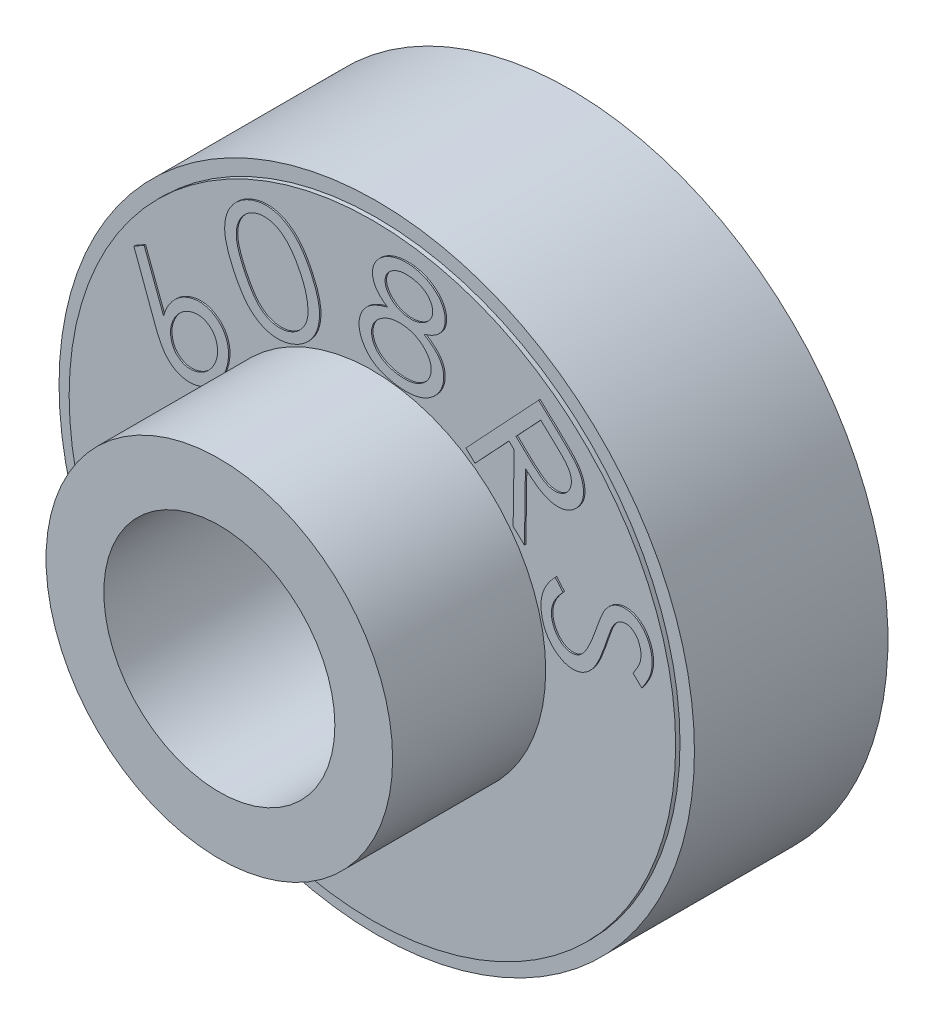
from build123d import *

# Parameters (mm, degrees)
SKETCH1_R           = 11
BOSS_EXTRUDE1_DEPTH = 7
SKETCH2_R           = 4
CUT_EXTRUDE1_DEPTH  = 18.058722109
BOSS_EXTRUDE2_START = 5.3
SKETCH3_R           = 6
SKETCH3_R_2         = 4
BOSS_EXTRUDE2_DEPTH = 5.3
CUT_EXTRUDE2_START  = -0.15
SKETCH4_R           = 11
SKETCH4_R_2         = 10.5
CUT_EXTRUDE2_DEPTH  = 0.15
SKETCH5_R           = 21
SKETCH5_R_2         = 10
CUT_EXTRUDE3_DEPTH  = 0.15
BOSS_EXTRUDE3_DEPTH = 0.05


with BuildPart() as part:
    # Sketch1 → Boss-Extrude1 (new body)
    with BuildSketch(Plane.XY):
        Circle(SKETCH1_R)
    extrude(amount=BOSS_EXTRUDE1_DEPTH)

    # Sketch2 → Cut-Extrude1 (cut, through all)
    with BuildSketch(Plane.XY.offset(7)):
        Circle(SKETCH2_R)
    extrude(amount=-CUT_EXTRUDE1_DEPTH, mode=Mode.SUBTRACT)

    # Sketch3 → Boss-Extrude2 (add)
    with BuildSketch(Plane.XY.offset(7).offset(BOSS_EXTRUDE2_START)):
        Circle(SKETCH3_R)
        Circle(SKETCH3_R_2, mode=Mode.SUBTRACT)
    extrude(amount=-BOSS_EXTRUDE2_DEPTH)

    # Sketch4 → Cut-Extrude2 (cut)
    with BuildSketch(Plane.XY.offset(7).offset(CUT_EXTRUDE2_START)):
        Circle(SKETCH4_R)
        Circle(SKETCH4_R_2, mode=Mode.SUBTRACT)
    extrude(amount=CUT_EXTRUDE2_DEPTH, mode=Mode.SUBTRACT)

    # Sketch5 → Cut-Extrude3 (cut)
    with BuildSketch(Plane(origin=(0, 0, 0), x_dir=(-1, 0, 0), z_dir=(0, 0, -1))):
        Circle(SKETCH5_R)
        Circle(SKETCH5_R_2, mode=Mode.SUBTRACT)
    extrude(amount=-CUT_EXTRUDE3_DEPTH, mode=Mode.SUBTRACT)

    # Sketch8 → Boss-Extrude3 (add)
    # profile 1 of 5: a face of its own
    with BuildSketch(Plane.XY.offset(7)):
        with BuildLine():
            Line((6.378778496, 3.007549075), (6.648131962, 2.692190334))
            add(Edge.make_bspline(
                [(6.648131962, 2.692190334), (6.609031635, 2.649307577), (6.533818589, 2.566818681), (6.43715366, 2.436922009), (6.3601824, 2.307647175), (6.301710334, 2.178949007), (6.263415079, 2.050609597), (6.244176513, 1.922963116), (6.245150647, 1.795821088), (6.261005358, 1.713307836), (6.268959452, 1.671912055)],
                knots=[0, 0, 0, 0, 1.224524167, 2.355484011, 3.411241252, 4.395197411, 5.331915322, 6.229090028, 7.111558467, 8, 8, 8, 8], degree=3))
            add(Edge.make_bspline(
                [(6.268959452, 1.671912055), (6.278641468, 1.637055208), (6.297709341, 1.568407735), (6.338400468, 1.470011998), (6.389160296, 1.378051204), (6.44778949, 1.292322911), (6.514020041, 1.216331489), (6.585574924, 1.151695012), (6.661898216, 1.099784491), (6.74195957, 1.061108556), (6.824105164, 1.035694376), (6.906072479, 1.022983014), (6.98761866, 1.022203641), (7.040266181, 1.032385495), (7.066631561, 1.037484471)],
                knots=[0, 0, 0, 0, 1.152674187, 2.27008969, 3.38536036, 4.496608802, 5.575283695, 6.591710815, 7.562861209, 8.50814768, 9.416117746, 10.293893154, 11.145597844, 12, 12, 12, 12], degree=3))
            add(Edge.make_bspline(
                [(7.066631561, 1.037484471), (7.096354164, 1.046376484), (7.156803326, 1.064460858), (7.239578135, 1.116136467), (7.318272565, 1.18268576), (7.362601996, 1.237964922), (7.385700404, 1.266768826)],
                knots=[0, 0, 0, 0, 0.925563858, 1.882390955, 2.896593112, 4, 4, 4, 4], degree=3))
            add(Edge.make_bspline(
                [(7.385700404, 1.266768826), (7.401753739, 1.289870412), (7.435674567, 1.338684256), (7.48456664, 1.418997293), (7.533441076, 1.510478092), (7.58194047, 1.613420271), (7.632729091, 1.726646121), (7.682575456, 1.851469182), (7.734090261, 1.986677759), (7.767080753, 2.080929076), (7.784165449, 2.129738745)],
                knots=[0, 0, 0, 0, 0.707852986, 1.495699242, 2.364580492, 3.316758505, 4.358943962, 5.487088347, 6.698645388, 8, 8, 8, 8], degree=3))
            add(Edge.make_bspline(
                [(7.784165449, 2.129738745), (7.801114293, 2.178506088), (7.833449926, 2.271546231), (7.881477769, 2.403813745), (7.927387848, 2.521773695), (7.970738202, 2.625685526), (8.009414508, 2.716512621), (8.04636927, 2.793117013), (8.080757038, 2.855628798), (8.104517271, 2.891423487), (8.115106621, 2.907376298)],
                knots=[0, 0, 0, 0, 1.462770368, 2.790727419, 3.986683802, 5.048638873, 5.980783097, 6.783139191, 7.457675118, 8, 8, 8, 8], degree=3))
            add(Edge.make_bspline(
                [(8.115106621, 2.907376298), (8.131759803, 2.93045908), (8.164311148, 2.975578122), (8.219315185, 3.036595874), (8.2762825, 3.091770782), (8.336363652, 3.140408881), (8.400177628, 3.181183477), (8.466077648, 3.216561412), (8.535717509, 3.244088559), (8.583686504, 3.257529337), (8.607808277, 3.264288191)],
                knots=[0, 0, 0, 0, 1.096990083, 2.144245076, 3.162959619, 4.153643437, 5.119398055, 6.079482833, 7.034245381, 8, 8, 8, 8], degree=3))
            add(Edge.make_bspline(
                [(8.607808277, 3.264288191), (8.646486998, 3.271975308), (8.722841757, 3.287150265), (8.839692871, 3.287879861), (8.955022735, 3.271535449), (9.068227857, 3.236923165), (9.177233867, 3.185790737), (9.279815415, 3.117933822), (9.375662863, 3.034893591), (9.462124339, 2.936108917), (9.540076963, 2.826210554), (9.605017746, 2.705799932), (9.659905721, 2.577746253), (9.684090604, 2.487262864), (9.696352448, 2.441387383)],
                knots=[0, 0, 0, 0, 0.933345565, 1.842495663, 2.754874964, 3.686283647, 4.638691146, 5.600067626, 6.593747552, 7.63654653, 8.705618078, 9.781729028, 10.875326747, 12, 12, 12, 12], degree=3))
            add(Edge.make_bspline(
                [(9.696352448, 2.441387383), (9.707019714, 2.391864217), (9.728089931, 2.294044983), (9.737367797, 2.144898634), (9.731945146, 1.997083965), (9.712417377, 1.874468808), (9.688070604, 1.775721033), (9.662650731, 1.699112647), (9.630031522, 1.620584318), (9.593319184, 1.538325123), (9.548580177, 1.454438581), (9.497790364, 1.367827695), (9.44055447, 1.278916241), (9.399233305, 1.219401843), (9.378025625, 1.188856667)],
                knots=[0, 0, 0, 0, 1.360256031, 2.686807307, 4.004512524, 5.330613728, 6.016044099, 6.737309068, 7.497960589, 8.301441016, 9.15808543, 10.052210119, 11.000316091, 12, 12, 12, 12], degree=3))
            Line((9.378025625, 1.188856667), (9.073797193, 1.480470749))
            add(Edge.make_bspline(
                [(9.073797193, 1.480470749), (9.090403688, 1.505179984), (9.122469906, 1.552892142), (9.168383102, 1.622446491), (9.207692517, 1.689475771), (9.241662241, 1.752943597), (9.270881315, 1.812834098), (9.29568561, 1.868740445), (9.314325469, 1.921647196), (9.332129165, 1.986972795), (9.345704563, 2.067299554), (9.351024077, 2.164127807), (9.344650248, 2.262434163), (9.330858152, 2.32699697), (9.323858123, 2.35976512)],
                knots=[0, 0, 0, 0, 1.131436103, 2.184740201, 3.166495598, 4.083236792, 4.919803993, 5.698613236, 6.406150164, 7.049183892, 8.269978557, 9.493700834, 10.727955128, 12, 12, 12, 12], degree=3))
            add(Edge.make_bspline(
                [(9.323858123, 2.35976512), (9.312485648, 2.400273078), (9.290601842, 2.478221658), (9.238829439, 2.584255299), (9.173279569, 2.674768445), (9.095023137, 2.747841791), (9.008690335, 2.802649684), (8.917328804, 2.83560099), (8.822377745, 2.847706911), (8.76031761, 2.836105782), (8.728757629, 2.830206159)],
                knots=[0, 0, 0, 0, 1.193356898, 2.296350651, 3.332124494, 4.351248378, 5.320234367, 6.215905125, 7.092718718, 8, 8, 8, 8], degree=3))
            add(Edge.make_bspline(
                [(8.728757629, 2.830206159), (8.709550579, 2.824734085), (8.671048103, 2.813764759), (8.616041659, 2.788837294), (8.563532582, 2.75752192), (8.513512721, 2.718020662), (8.465396305, 2.668519737), (8.417616717, 2.607809754), (8.371353615, 2.534103981), (8.343002485, 2.47969659), (8.328066524, 2.45103365)],
                knots=[0, 0, 0, 0, 0.838196921, 1.680250597, 2.528629587, 3.401851773, 4.349855777, 5.422707971, 6.642229246, 8, 8, 8, 8], degree=3))
            add(Edge.make_bspline(
                [(8.328066524, 2.45103365), (8.323275502, 2.440436468), (8.311803892, 2.415062603), (8.294394839, 2.369265597), (8.272196367, 2.310470694), (8.246248847, 2.237894955), (8.21578561, 2.152168032), (8.181790527, 2.052354214), (8.143261161, 1.939384711), (8.116544459, 1.859411569), (8.102492271, 1.817348086)],
                knots=[0, 0, 0, 0, 0.414771559, 0.993127911, 1.746959378, 2.65679128, 3.742298553, 4.99229321, 6.418036107, 8, 8, 8, 8], degree=3))
            add(Edge.make_bspline(
                [(8.102492271, 1.817348086), (8.085251418, 1.766529202), (8.05186341, 1.668115205), (7.998210248, 1.52723695), (7.944980027, 1.397239161), (7.891793022, 1.278566722), (7.838528332, 1.171111958), (7.784271603, 1.075419959), (7.730670192, 0.990298915), (7.675062005, 0.916754318), (7.618509761, 0.852543827), (7.562372758, 0.793917363), (7.503589076, 0.742784901), (7.443122761, 0.697747129), (7.380825474, 0.659468014), (7.317442244, 0.626170429), (7.252056948, 0.599914387), (7.207012548, 0.587872195), (7.184612831, 0.581883844)],
                knots=[0, 0, 0, 0, 1.604189213, 3.106614316, 4.505873104, 5.803244957, 6.99371767, 8.089733873, 9.090710504, 9.998745564, 10.842515633, 11.647790772, 12.423390712, 13.168757731, 13.899268891, 14.607008315, 15.307291919, 16, 16, 16, 16], degree=3))
            add(Edge.make_bspline(
                [(7.184612831, 0.581883844), (7.152335259, 0.575127127), (7.088491298, 0.561762566), (6.991153501, 0.55619697), (6.894582878, 0.562348712), (6.798360069, 0.579331607), (6.702804604, 0.608712099), (6.608043353, 0.64987402), (6.514359935, 0.703396097), (6.421679448, 0.766443427), (6.333188869, 0.839173669), (6.252499798, 0.920621292), (6.178158876, 1.007573856), (6.112946234, 1.102261607), (6.055432925, 1.20387394), (6.006221881, 1.312332341), (5.962936905, 1.427102677), (5.942000013, 1.507208914), (5.931340095, 1.547994621)],
                knots=[0, 0, 0, 0, 0.902134718, 1.784392393, 2.659889174, 3.547487472, 4.453884507, 5.391362443, 6.371035156, 7.404386878, 8.458162068, 9.50233591, 10.540516301, 11.587126138, 12.64576687, 13.733903036, 14.846227594, 16, 16, 16, 16], degree=3))
            add(Edge.make_bspline(
                [(5.931340095, 1.547994621), (5.924346073, 1.579837823), (5.910477017, 1.642982481), (5.895386335, 1.738044303), (5.887341677, 1.832282428), (5.885337937, 1.925438154), (5.887773921, 2.017683612), (5.897788017, 2.109120277), (5.913222968, 2.199619165), (5.934988609, 2.289367358), (5.962950316, 2.378938967), (6.000008479, 2.468129922), (6.043563743, 2.558146076), (6.095902879, 2.647832521), (6.15559661, 2.737833067), (6.222420077, 2.828250479), (6.296606117, 2.919226302), (6.350983673, 2.97767388), (6.378778496, 3.007549075)],
                knots=[0, 0, 0, 0, 0.977119722, 1.937615821, 2.882708834, 3.809715642, 4.729519861, 5.646511125, 6.564311248, 7.479592573, 8.412804513, 9.373786917, 10.371833778, 11.408219121, 12.483646423, 13.60763184, 14.777152683, 16, 16, 16, 16], degree=3))
        make_face()
    # profile 2 of 5: a face of its own
    with BuildSketch(Plane.XY.offset(7)):
        with BuildLine():
            Line((5.80730942, 8.032313426), (6.439510942, 7.440181014))
            add(Edge.make_bspline(
                [(6.439510942, 7.440181014), (6.481610159, 7.40041354), (6.562113527, 7.324368997), (6.676899336, 7.214320998), (6.779816172, 7.11291494), (6.871182369, 7.020474582), (6.95037465, 6.936350689), (7.017296792, 6.86062202), (7.074847996, 6.795355777), (7.106346528, 6.752530885), (7.120685822, 6.733035414)],
                knots=[0, 0, 0, 0, 1.413961365, 2.703818786, 3.882427241, 4.941473356, 5.877126586, 6.702614307, 7.40938217, 8, 8, 8, 8], degree=3))
            add(Edge.make_bspline(
                [(7.120685822, 6.733035414), (7.139097122, 6.706555126), (7.17536084, 6.654398368), (7.222987753, 6.573066614), (7.263722208, 6.491034105), (7.297701639, 6.408087672), (7.323324433, 6.32425253), (7.342950332, 6.239741529), (7.355685561, 6.154400841), (7.360827788, 6.068494954), (7.358686946, 5.9835803), (7.349201607, 5.900534361), (7.331433155, 5.820158633), (7.30498842, 5.74220318), (7.271093199, 5.666810635), (7.228896171, 5.5941225), (7.179136772, 5.523889313), (7.140411967, 5.480398166), (7.120685822, 5.458244082)],
                knots=[0, 0, 0, 0, 1.11329001, 2.192785671, 3.250749648, 4.273662645, 5.283948374, 6.27421852, 7.267026458, 8.259503747, 9.241972731, 10.196425632, 11.14127808, 12.078418266, 13.034016741, 13.990568812, 14.976409849, 16, 16, 16, 16], degree=3))
            add(Edge.make_bspline(
                [(7.120685822, 5.458244082), (7.103347656, 5.440698589), (7.068996155, 5.40593632), (7.014347464, 5.358593572), (6.957180794, 5.316589942), (6.89817693, 5.279347182), (6.836176012, 5.248127455), (6.772008321, 5.222308505), (6.706039025, 5.200283974), (6.637604431, 5.185138769), (6.56796282, 5.174435802), (6.496951799, 5.170243923), (6.425052545, 5.171005953), (6.352095525, 5.176823298), (6.278414647, 5.188796781), (6.204161727, 5.206906841), (6.128763384, 5.229986181), (6.052067745, 5.258989946), (5.973594963, 5.295123982), (5.892448193, 5.338260111), (5.808799521, 5.389809244), (5.721976963, 5.44857221), (5.631962693, 5.514711559), (5.53951231, 5.589164348), (5.44366235, 5.670724936), (5.379976536, 5.728882694), (5.347256669, 5.758762411)],
                knots=[0, 0, 0, 0, 0.874587974, 1.73279054, 2.560877705, 3.388407172, 4.204372709, 5.018828071, 5.839916796, 6.667678683, 7.501322298, 8.336303176, 9.187212487, 10.049707882, 10.929383772, 11.831472353, 12.758215692, 13.724308534, 14.737023547, 15.820082704, 16.981476287, 18.219822595, 19.537403407, 20.941575706, 22.428673062, 24, 24, 24, 24], degree=3))
            Line((5.347256669, 5.758762411), (5.314607764, 3.43772208))
            Line((5.314607764, 3.43772208), (4.922078885, 3.80502226))
            Line((4.922078885, 3.80502226), (4.956953851, 6.12383653))
            Line((4.956953851, 6.12383653), (4.775900833, 6.293017219))
            Line((4.775900833, 6.293017219), (3.602766318, 5.039744482))
            Line((3.602766318, 5.039744482), (3.285181515, 5.337294729))
            Line((3.285181515, 5.337294729), (5.80730942, 8.032313426))
        make_face()
        with BuildLine():
            Line((5.877801374, 7.470603857), (5.02076762, 6.554950479))
            Line((5.02076762, 6.554950479), (5.562442633, 6.040730226))
            add(Edge.make_bspline(
                [(5.562442633, 6.040730226), (5.588039415, 6.017091705), (5.637722885, 5.971209226), (5.711673168, 5.907137169), (5.781659675, 5.848642258), (5.848139429, 5.797140717), (5.910502694, 5.751098906), (5.96995335, 5.713041299), (6.02481717, 5.679516712), (6.093062224, 5.645671281), (6.175910184, 5.613588203), (6.275421666, 5.591259293), (6.373796731, 5.58285212), (6.469853274, 5.592597452), (6.561937249, 5.614616519), (6.646409758, 5.652988825), (6.725100453, 5.701737238), (6.768970382, 5.744983008), (6.791228691, 5.766924637)],
                knots=[0, 0, 0, 0, 1.177793609, 2.286102804, 3.307446297, 4.260811049, 5.12884429, 5.926661755, 6.646533488, 7.300929225, 8.499785947, 9.639813712, 10.738365136, 11.821663501, 12.890407205, 13.923626987, 14.94650955, 16, 16, 16, 16], degree=3))
            add(Edge.make_bspline(
                [(6.791228691, 5.766924637), (6.810898639, 5.790040301), (6.849979674, 5.835967422), (6.893085449, 5.91598694), (6.922203825, 6.00258658), (6.937657735, 6.094512893), (6.93877338, 6.188991562), (6.927275622, 6.283667163), (6.899902643, 6.376346308), (6.865318755, 6.45194337), (6.829225847, 6.513620457), (6.793707651, 6.563842361), (6.752361518, 6.618924099), (6.703083714, 6.677397268), (6.646650564, 6.739761976), (6.582451992, 6.805477305), (6.512244568, 6.876286732), (6.461921573, 6.923641394), (6.43580084, 6.948221379)],
                knots=[0, 0, 0, 0, 1.044620257, 2.075493067, 3.111507418, 4.184485163, 5.276658662, 6.360268061, 7.46186446, 8.59582455, 9.219154423, 9.924390251, 10.716126751, 11.594380726, 12.560822808, 13.616705115, 14.762923209, 16, 16, 16, 16], degree=3))
            Line((6.43580084, 6.948221379), (5.877801374, 7.470603857))
        make_face(mode=Mode.SUBTRACT)
    # profile 3 of 5: a face of its own
    with BuildSketch(Plane.XY.offset(7)):
        with BuildLine():
            add(Edge.make_bspline(
                [(1.83778186, 8.021996294), (1.87060903, 8.001744568), (1.934620247, 7.96225479), (2.025096581, 7.89998578), (2.107719041, 7.837008729), (2.181935783, 7.77320796), (2.24845649, 7.709149899), (2.307355792, 7.644765592), (2.35796559, 7.579470052), (2.400586357, 7.513514693), (2.436687363, 7.447176889), (2.465637459, 7.379236214), (2.488597177, 7.310220465), (2.505997135, 7.240321663), (2.51631664, 7.168975135), (2.520580142, 7.096525073), (2.51961477, 7.022729947), (2.513256725, 6.973729209), (2.510052493, 6.949034555)],
                knots=[0, 0, 0, 0, 1.369391517, 2.670239865, 3.898067222, 5.056399231, 6.14331331, 7.175373907, 8.152066955, 9.072869418, 9.96092473, 10.830416964, 11.691351346, 12.541240426, 13.384570075, 14.24684722, 15.116472502, 16, 16, 16, 16], degree=3))
            add(Edge.make_bspline(
                [(2.510052493, 6.949034555), (2.504167305, 6.914473208), (2.492497589, 6.845941645), (2.461238754, 6.747221438), (2.421673207, 6.652754907), (2.372894995, 6.56249804), (2.312688568, 6.477917866), (2.24413662, 6.397002491), (2.165250474, 6.321298212), (2.107044871, 6.275539767), (2.077454503, 6.252277244)],
                knots=[0, 0, 0, 0, 0.997464771, 1.977869028, 2.940781759, 3.911700511, 4.892762536, 5.89216563, 6.928426278, 8, 8, 8, 8], degree=3))
            add(Edge.make_bspline(
                [(2.077454503, 6.252277244), (2.038699034, 6.225625616), (1.960899289, 6.172123751), (1.832772256, 6.108174404), (1.695483345, 6.059580606), (1.54980659, 6.02394663), (1.395526076, 6.001405724), (1.232323461, 5.995061038), (1.060315511, 6.000400034), (0.943560364, 6.015322253), (0.883543411, 6.022992889)],
                knots=[0, 0, 0, 0, 0.903796598, 1.81432836, 2.744225757, 3.699534768, 4.694525907, 5.737399208, 6.836930042, 8, 8, 8, 8], degree=3))
            add(Edge.make_bspline(
                [(0.883543411, 6.022992889), (0.825983524, 6.032248746), (0.714263982, 6.05021369), (0.554238062, 6.091004816), (0.405931787, 6.139166758), (0.270639442, 6.198198874), (0.146624094, 6.264739235), (0.035869251, 6.342257817), (-0.06305824, 6.428538325), (-0.147998204, 6.523923171), (-0.220833203, 6.62368574), (-0.282703825, 6.724671416), (-0.333358956, 6.826252391), (-0.3708735, 6.928935203), (-0.398572089, 7.031631914), (-0.412104242, 7.135310995), (-0.416263747, 7.239439686), (-0.408001446, 7.308466854), (-0.403862271, 7.343047476)],
                knots=[0, 0, 0, 0, 1.360425189, 2.640486012, 3.851147238, 4.996828312, 6.082128045, 7.131374271, 8.146096692, 9.13971705, 10.106411377, 11.026431221, 11.901880249, 12.75142724, 13.574966078, 14.379353803, 15.188102953, 16, 16, 16, 16], degree=3))
            add(Edge.make_bspline(
                [(-0.403862271, 7.343047476), (-0.399538141, 7.368104771), (-0.390988653, 7.417647005), (-0.371644281, 7.4903149), (-0.34563946, 7.559700475), (-0.314031155, 7.62627048), (-0.277722268, 7.690702218), (-0.234728156, 7.751860982), (-0.185889902, 7.810241511), (-0.131635714, 7.866144722), (-0.070335272, 7.919394415), (-0.000762362, 7.968661229), (0.075560134, 8.016693559), (0.160951278, 8.059919845), (0.253289458, 8.101751592), (0.354045631, 8.138957052), (0.461726961, 8.17515084), (0.536901521, 8.195526869), (0.575604877, 8.206017395)],
                knots=[0, 0, 0, 0, 0.875972108, 1.731935413, 2.586879614, 3.425696199, 4.269348995, 5.132412345, 5.997829432, 6.889908943, 7.81442224, 8.791393582, 9.824986942, 10.91908505, 12.086553594, 13.316596125, 14.618459045, 16, 16, 16, 16], degree=3))
            add(Edge.make_bspline(
                [(0.575604877, 8.206017395), (0.529135158, 8.236948346), (0.439867636, 8.296366166), (0.322427036, 8.397694777), (0.226147059, 8.504671633), (0.149984349, 8.616128761), (0.096308217, 8.732037027), (0.062220392, 8.849050034), (0.047480109, 8.967421386), (0.054769315, 9.045501559), (0.058416542, 9.084569745)],
                knots=[0, 0, 0, 0, 1.239582721, 2.381216886, 3.436041529, 4.429940491, 5.36927454, 6.261639813, 7.130194322, 8, 8, 8, 8], degree=3))
            add(Edge.make_bspline(
                [(0.058416542, 9.084569745), (0.066426553, 9.124056241), (0.08253976, 9.203488592), (0.133029875, 9.317552987), (0.203667746, 9.426183071), (0.293732985, 9.529214247), (0.401150938, 9.622594806), (0.524565688, 9.70281955), (0.662075559, 9.768189645), (0.812265082, 9.817861899), (0.970986586, 9.852264731), (1.135019542, 9.871435113), (1.303041774, 9.871251117), (1.415161958, 9.858353411), (1.471965721, 9.85181901)],
                knots=[0, 0, 0, 0, 0.816012511, 1.641517967, 2.513459017, 3.43885091, 4.410536986, 5.393831085, 6.418009756, 7.493033865, 8.598140612, 9.709969268, 10.839795307, 12, 12, 12, 12], degree=3))
            add(Edge.make_bspline(
                [(1.471965721, 9.85181901), (1.526924643, 9.842471493), (1.635311946, 9.824036776), (1.790937843, 9.774401703), (1.938650817, 9.711518835), (2.075423404, 9.632367205), (2.200049589, 9.541575066), (2.30927992, 9.440883948), (2.400451079, 9.329329079), (2.473466869, 9.209937593), (2.527943124, 9.085806655), (2.561788185, 8.960073095), (2.577035249, 8.834108115), (2.568478179, 8.7511374), (2.564219994, 8.709849359)],
                knots=[0, 0, 0, 0, 1.147536699, 2.26311586, 3.356681345, 4.450377478, 5.511620911, 6.528600966, 7.502960909, 8.470632415, 9.404254499, 10.285795838, 11.146974542, 12, 12, 12, 12], degree=3))
            add(Edge.make_bspline(
                [(2.564219994, 8.709849359), (2.55677813, 8.669624678), (2.542157014, 8.590594783), (2.49501779, 8.479507355), (2.430505658, 8.378273546), (2.347464343, 8.286516883), (2.245636287, 8.205594034), (2.126504394, 8.133349457), (1.98900836, 8.071089439), (1.889590554, 8.038815117), (1.83778186, 8.021996294)],
                knots=[0, 0, 0, 0, 0.922552276, 1.812549092, 2.707643608, 3.626238492, 4.596519178, 5.638052114, 6.769139642, 8, 8, 8, 8], degree=3))
        make_face()
        with BuildLine():
            add(Edge.make_bspline(
                [(1.399989726, 9.500101262), (1.371089041, 9.503722835), (1.314419305, 9.510824176), (1.230084863, 9.514392664), (1.148752955, 9.512288653), (1.070243058, 9.504415308), (0.99508028, 9.489346569), (0.922810793, 9.468603576), (0.853506544, 9.441811461), (0.788044051, 9.409363529), (0.727256467, 9.372624314), (0.672993414, 9.331652538), (0.625093438, 9.288029482), (0.584489909, 9.24068339), (0.550816396, 9.190203341), (0.52484759, 9.136142115), (0.504911882, 9.079173738), (0.497661865, 9.039437401), (0.493982614, 9.019271935)],
                knots=[0, 0, 0, 0, 1.22983298, 2.411510652, 3.561119232, 4.664068091, 5.739713862, 6.794457388, 7.836290726, 8.873504403, 9.876861447, 10.831728903, 11.741107022, 12.607964757, 13.459836128, 14.296191773, 15.135348414, 16, 16, 16, 16], degree=3))
            add(Edge.make_bspline(
                [(0.493982614, 9.019271935), (0.491583031, 8.999012061), (0.486817223, 8.958773954), (0.491542031, 8.89786461), (0.502369786, 8.837224833), (0.522150415, 8.77710444), (0.548984176, 8.716857638), (0.585073681, 8.657851304), (0.628504007, 8.598760945), (0.679221027, 8.541020338), (0.735225998, 8.486043263), (0.796419239, 8.436635804), (0.860263027, 8.39199319), (0.928541764, 8.354464758), (0.999187717, 8.320758519), (1.074592554, 8.295974453), (1.152472807, 8.273189185), (1.206441599, 8.2645571), (1.233777119, 8.260184896)],
                knots=[0, 0, 0, 0, 0.839181798, 1.666697762, 2.50668453, 3.374135234, 4.268671695, 5.21998804, 6.219330182, 7.288880787, 8.38493415, 9.450345141, 10.527982559, 11.59168432, 12.659240174, 13.749205362, 14.85995886, 16, 16, 16, 16], degree=3))
            add(Edge.make_bspline(
                [(1.233777119, 8.260184896), (1.269098219, 8.256192422), (1.339106879, 8.248279087), (1.444693029, 8.250141221), (1.548787843, 8.263298042), (1.650164768, 8.288847018), (1.746583677, 8.323569945), (1.835377408, 8.369125521), (1.914386365, 8.425057751), (1.983124979, 8.489560152), (2.041123486, 8.559485114), (2.085806788, 8.633319152), (2.118649695, 8.709157406), (2.128823546, 8.761775319), (2.133848066, 8.787761518)],
                knots=[0, 0, 0, 0, 1.110757148, 2.201591101, 3.293494243, 4.385424786, 5.464677261, 6.492236056, 7.496707312, 8.481839473, 9.432693192, 10.328190847, 11.174350281, 12, 12, 12, 12], degree=3))
            add(Edge.make_bspline(
                [(2.133848066, 8.787761518), (2.135716757, 8.806040779), (2.139473868, 8.842792283), (2.138110525, 8.898436901), (2.128945639, 8.953729817), (2.112928589, 9.008625682), (2.090771515, 9.063437983), (2.061349271, 9.117943456), (2.025458779, 9.172209027), (1.983414755, 9.226121632), (1.934937229, 9.278394241), (1.878102415, 9.324798105), (1.815021621, 9.366873413), (1.745148328, 9.403826463), (1.668366366, 9.435762506), (1.584806596, 9.462084643), (1.494941254, 9.484757557), (1.432239157, 9.494889911), (1.399989726, 9.500101262)],
                knots=[0, 0, 0, 0, 0.775843954, 1.559878863, 2.343286739, 3.137080502, 3.971518225, 4.836416561, 5.749409475, 6.717270043, 7.722652837, 8.754251326, 9.809244095, 10.92187135, 12.088261757, 13.317646504, 14.620391026, 16, 16, 16, 16], degree=3))
        make_face(mode=Mode.SUBTRACT)
        with BuildLine():
            add(Edge.make_bspline(
                [(1.191481946, 7.929243723), (1.155173511, 7.933763718), (1.083730546, 7.942657568), (0.977503951, 7.946137572), (0.874554594, 7.941785362), (0.774624044, 7.929509706), (0.678247112, 7.907511793), (0.584766165, 7.879037171), (0.495371095, 7.840534456), (0.410146523, 7.795205049), (0.331306533, 7.74329966), (0.259484418, 7.688124281), (0.197525847, 7.627796701), (0.145264244, 7.563225776), (0.100822408, 7.495761336), (0.066538576, 7.423531856), (0.040781779, 7.347557079), (0.031292144, 7.294727764), (0.026509657, 7.268103399)],
                knots=[0, 0, 0, 0, 1.183878328, 2.329480105, 3.43539451, 4.516839077, 5.583242124, 6.631610083, 7.67553572, 8.728601211, 9.752313523, 10.727671212, 11.656195934, 12.543994127, 13.412300357, 14.264586863, 15.125404679, 16, 16, 16, 16], degree=3))
            add(Edge.make_bspline(
                [(0.026509657, 7.268103399), (0.02304585, 7.234725529), (0.016107371, 7.167865111), (0.028136652, 7.066600966), (0.053964719, 6.965857761), (0.097503698, 6.867446389), (0.155967267, 6.773352451), (0.229606267, 6.686248142), (0.318132399, 6.608431462), (0.419398555, 6.538558509), (0.533372867, 6.478317324), (0.659080404, 6.429999805), (0.795465284, 6.391487831), (0.890769447, 6.375525445), (0.939936975, 6.367290431)],
                knots=[0, 0, 0, 0, 0.843733217, 1.69011249, 2.553774946, 3.458601658, 4.391300441, 5.338274472, 6.323271658, 7.354237139, 8.43380958, 9.565215747, 10.743892009, 12, 12, 12, 12], degree=3))
            add(Edge.make_bspline(
                [(0.939936975, 6.367290431), (0.978216751, 6.362188484), (1.053078483, 6.352210875), (1.16351621, 6.348523495), (1.269221352, 6.35070733), (1.369799221, 6.362631159), (1.465674806, 6.382710837), (1.556448775, 6.410833105), (1.642298967, 6.447260862), (1.722042228, 6.491805073), (1.795420335, 6.542188199), (1.861299903, 6.596784898), (1.919369437, 6.655123907), (1.968384383, 6.717412387), (2.009009527, 6.783757767), (2.041712972, 6.853304506), (2.066104145, 6.927069187), (2.075111933, 6.978074737), (2.079680564, 7.003944077)],
                knots=[0, 0, 0, 0, 1.274581103, 2.492630801, 3.644811804, 4.763349713, 5.831887748, 6.875630341, 7.8966893, 8.905851765, 9.886887487, 10.832320339, 11.727587489, 12.600172587, 13.44351805, 14.291282269, 15.133360971, 16, 16, 16, 16], degree=3))
            add(Edge.make_bspline(
                [(2.079680564, 7.003944077), (2.08266799, 7.029138605), (2.088605714, 7.079214538), (2.083982469, 7.15485522), (2.071201821, 7.229685313), (2.05024741, 7.304150554), (2.016979744, 7.37666634), (1.976288826, 7.449029357), (1.92526078, 7.520383599), (1.865635977, 7.590075309), (1.799148944, 7.656207098), (1.726403924, 7.715650282), (1.650054732, 7.769656178), (1.567983346, 7.815837014), (1.480461639, 7.854168776), (1.388640236, 7.887056556), (1.291743822, 7.912363355), (1.225220251, 7.923563449), (1.191481946, 7.929243723)],
                knots=[0, 0, 0, 0, 0.859075559, 1.707474348, 2.558482517, 3.432020549, 4.322200417, 5.257719341, 6.244714883, 7.292119494, 8.365904539, 9.42077552, 10.475112559, 11.534477969, 12.608656246, 13.712533456, 14.839881249, 16, 16, 16, 16], degree=3))
        make_face(mode=Mode.SUBTRACT)
    # profile 4 of 5: a face of its own
    with BuildSketch(Plane.XY.offset(7)):
        with BuildLine():
            add(Edge.make_bspline(
                [(-4.751168751, 6.633371837), (-4.775749424, 6.687140669), (-4.82357255, 6.791751049), (-4.887519506, 6.946469086), (-4.941256464, 7.094524191), (-4.985124943, 7.235725249), (-5.020264801, 7.369824894), (-5.046235356, 7.49706987), (-5.060848156, 7.617672572), (-5.067493187, 7.732004763), (-5.063651926, 7.841051796), (-5.055368199, 7.946218933), (-5.039121485, 8.047987453), (-5.014953829, 8.145970081), (-4.985568123, 8.240988379), (-4.948247587, 8.332167621), (-4.904459831, 8.42005126), (-4.853719488, 8.50390057), (-4.797642263, 8.583907172), (-4.73565367, 8.659108348), (-4.668732242, 8.729794797), (-4.596803305, 8.795714398), (-4.52012943, 8.856986338), (-4.438010159, 8.912576653), (-4.351296549, 8.963960991), (-4.290574277, 8.994114719), (-4.259951136, 9.00932169)],
                knots=[0, 0, 0, 0, 1.546448947, 3.008706145, 4.377939173, 5.66516415, 6.875090384, 8.003135421, 9.059249397, 10.050527188, 10.995516431, 11.911098628, 12.808858693, 13.687649939, 14.549145804, 15.40820861, 16.261796197, 17.115089477, 17.96953488, 18.815362979, 19.662056755, 20.513803257, 21.365623478, 22.227022153, 23.105861034, 24, 24, 24, 24], degree=3))
            add(Edge.make_bspline(
                [(-4.259951136, 9.00932169), (-4.228241259, 9.023658421), (-4.16565005, 9.051957279), (-4.069093113, 9.085616971), (-3.972745492, 9.114408846), (-3.875230579, 9.135194893), (-3.77722832, 9.148373496), (-3.678816979, 9.155163546), (-3.580148394, 9.155091844), (-3.481194741, 9.148528397), (-3.382375721, 9.134593081), (-3.28468696, 9.112195272), (-3.188116241, 9.082379411), (-3.093256151, 9.044316236), (-2.999212982, 8.998830819), (-2.906739494, 8.945478623), (-2.815671509, 8.884028696), (-2.725705015, 8.814950142), (-2.636938389, 8.736879103), (-2.550611843, 8.64787336), (-2.466262029, 8.548163202), (-2.383156394, 8.438268495), (-2.302071342, 8.317676521), (-2.223944114, 8.185942486), (-2.14618339, 8.044246386), (-2.098458828, 7.944519426), (-2.073958548, 7.893322759)],
                knots=[0, 0, 0, 0, 0.902413412, 1.781247763, 2.650352977, 3.509954282, 4.364824219, 5.213821681, 6.067269506, 6.922669117, 7.784781608, 8.653412911, 9.520074715, 10.404234251, 11.302531627, 12.228190439, 13.171453049, 14.150740251, 15.169108697, 16.235492609, 17.364429573, 18.55541745, 19.808357411, 21.132246654, 22.52778615, 24, 24, 24, 24], degree=3))
            add(Edge.make_bspline(
                [(-2.073958548, 7.893322759), (-2.050544439, 7.842054632), (-2.004860705, 7.742024374), (-1.944893229, 7.592677544), (-1.893214374, 7.448817385), (-1.851617399, 7.310107624), (-1.819230902, 7.176905203), (-1.796948534, 7.048971892), (-1.783286957, 6.926542093), (-1.778762083, 6.809242581), (-1.782451854, 6.696673774), (-1.793771143, 6.587895452), (-1.811300475, 6.482726453), (-1.835965611, 6.381340904), (-1.866918616, 6.283661345), (-1.905869398, 6.190087687), (-1.950984803, 6.099742488), (-2.00397445, 6.014217869), (-2.0615964, 5.932375186), (-2.125096458, 5.855707865), (-2.193271501, 5.783824485), (-2.26645526, 5.716372376), (-2.344953945, 5.654666078), (-2.427769856, 5.596699412), (-2.516184028, 5.545006436), (-2.577856655, 5.514304162), (-2.608955376, 5.498822392)],
                knots=[0, 0, 0, 0, 1.462643906, 2.853793505, 4.175600684, 5.428717407, 6.610496566, 7.731318237, 8.796818257, 9.805413948, 10.775288243, 11.717467357, 12.641963107, 13.540347773, 14.423465264, 15.29849618, 16.168378561, 17.041452833, 17.907108655, 18.764393061, 19.622614324, 20.47676845, 21.344991155, 22.212216531, 23.098501498, 24, 24, 24, 24], degree=3))
            add(Edge.make_bspline(
                [(-2.608955376, 5.498822392), (-2.640205115, 5.484831009), (-2.701954062, 5.457184276), (-2.7965546, 5.422844209), (-2.891870308, 5.396182535), (-2.987560978, 5.376119434), (-3.083503377, 5.36267778), (-3.179694983, 5.356027094), (-3.276430724, 5.35576501), (-3.373332788, 5.36358395), (-3.469780956, 5.376996485), (-3.564641559, 5.399933176), (-3.658031117, 5.429304905), (-3.749887669, 5.466951159), (-3.840428587, 5.511475066), (-3.929888277, 5.563519415), (-4.017278167, 5.624047007), (-4.104170392, 5.691690945), (-4.189168568, 5.769653622), (-4.27328034, 5.858147252), (-4.355519786, 5.958994179), (-4.437095689, 6.071314582), (-4.517764537, 6.195179551), (-4.597118514, 6.330809598), (-4.675739985, 6.477639726), (-4.725562688, 6.580504922), (-4.751168751, 6.633371837)],
                knots=[0, 0, 0, 0, 0.896726929, 1.771917045, 2.633449417, 3.48739536, 4.331327259, 5.169193283, 6.011506902, 6.862769294, 7.714031685, 8.55955394, 9.416101512, 10.276390392, 11.157294125, 12.057432185, 12.984792388, 13.940071481, 14.939906647, 16.0031891, 17.135609396, 18.346066506, 19.638202623, 21.006140589, 22.461324919, 24, 24, 24, 24], degree=3))
        make_face()
        with BuildLine():
            add(Edge.make_bspline(
                [(-4.377932406, 6.801068485), (-4.355975665, 6.755405254), (-4.313544572, 6.667161702), (-4.246969117, 6.541473147), (-4.182145648, 6.425471256), (-4.116873643, 6.319939955), (-4.051880169, 6.224992026), (-3.987005912, 6.140491699), (-3.922767338, 6.066203437), (-3.858254577, 6.00152117), (-3.793205031, 5.945278383), (-3.726577672, 5.896302855), (-3.659404441, 5.852091639), (-3.589963363, 5.814981319), (-3.519489773, 5.783815462), (-3.447643234, 5.75818797), (-3.3741347, 5.738953678), (-3.275306828, 5.721550812), (-3.152322659, 5.712672904), (-3.007787514, 5.723342414), (-2.86798024, 5.752828417), (-2.780882903, 5.789275509), (-2.737324934, 5.807502947)],
                knots=[0, 0, 0, 0, 1.403200452, 2.711665112, 3.938651818, 5.083076024, 6.14717822, 7.124138258, 8.032159898, 8.8653347, 9.652219067, 10.411266308, 11.1542226, 11.877559525, 12.589122388, 13.286798626, 13.987997403, 14.690800602, 16.064254532, 17.389876203, 18.694659415, 20, 20, 20, 20], degree=3))
            add(Edge.make_bspline(
                [(-2.737324934, 5.807502947), (-2.695248362, 5.829507506), (-2.611538076, 5.873285023), (-2.499775924, 5.961074437), (-2.40040536, 6.064008586), (-2.329955213, 6.162331021), (-2.281298064, 6.248022934), (-2.250513532, 6.316237497), (-2.224135378, 6.386983882), (-2.20398901, 6.460984702), (-2.190333532, 6.53801447), (-2.18111635, 6.618044532), (-2.178314601, 6.700904827), (-2.180463195, 6.757047766), (-2.18155153, 6.785486053)],
                knots=[0, 0, 0, 0, 1.424914576, 2.83483179, 4.249388028, 5.714475853, 6.456905842, 7.208880641, 7.96166374, 8.724659478, 9.510746367, 10.31132841, 11.144631029, 12, 12, 12, 12], degree=3))
            add(Edge.make_bspline(
                [(-2.18155153, 6.785486053), (-2.184152963, 6.821384555), (-2.189424657, 6.894131362), (-2.20435705, 7.004462729), (-2.226885948, 7.117081498), (-2.255899138, 7.232224578), (-2.291653053, 7.349566499), (-2.334111218, 7.46909725), (-2.383150575, 7.591136728), (-2.420159148, 7.672341315), (-2.439032667, 7.713753782)],
                knots=[0, 0, 0, 0, 0.891046749, 1.805668862, 2.754506989, 3.733347134, 4.744640042, 5.790608367, 6.873261225, 8, 8, 8, 8], degree=3))
            add(Edge.make_bspline(
                [(-2.439032667, 7.713753782), (-2.458703899, 7.754750875), (-2.497097439, 7.834767394), (-2.559516205, 7.949041873), (-2.620960569, 8.057064634), (-2.685853728, 8.15612544), (-2.75102954, 8.248261922), (-2.818730811, 8.331778476), (-2.886893046, 8.40872571), (-2.956670326, 8.477744507), (-3.027438477, 8.539514671), (-3.098495121, 8.594745288), (-3.170821394, 8.642386059), (-3.243521415, 8.683208587), (-3.316762244, 8.717865295), (-3.390703792, 8.745326882), (-3.465506215, 8.765538459), (-3.564436649, 8.782805508), (-3.686606153, 8.791493435), (-3.830024626, 8.782138509), (-3.968154316, 8.752120684), (-4.054365097, 8.716310891), (-4.097448632, 8.698415073)],
                knots=[0, 0, 0, 0, 1.260037198, 2.459291181, 3.608029907, 4.703241048, 5.739997012, 6.734580003, 7.68130639, 8.587764618, 9.452542662, 10.283455439, 11.080095738, 11.85046591, 12.592593851, 13.323524396, 14.033583663, 14.73686004, 16.104400377, 17.416757301, 18.709033539, 20, 20, 20, 20], degree=3))
            add(Edge.make_bspline(
                [(-4.097448632, 8.698415073), (-4.139514102, 8.67640025), (-4.223510239, 8.632441152), (-4.336221457, 8.544068783), (-4.435664804, 8.438933974), (-4.506725264, 8.339205813), (-4.556555408, 8.252885655), (-4.587234652, 8.183726353), (-4.613379446, 8.112354102), (-4.634315691, 8.03821542), (-4.649926314, 7.96134783), (-4.659316687, 7.881429166), (-4.663910774, 7.798898774), (-4.662396896, 7.712831231), (-4.653919091, 7.621835217), (-4.638253239, 7.524627867), (-4.61419343, 7.420607358), (-4.581915166, 7.31008079), (-4.542260125, 7.192612856), (-4.495608826, 7.067981551), (-4.44045871, 6.936393988), (-4.399243642, 6.847192333), (-4.377932406, 6.801068485)],
                knots=[0, 0, 0, 0, 1.312767893, 2.621328903, 3.94413873, 5.309043331, 6.002376263, 6.701404917, 7.401372766, 8.106150987, 8.832956775, 9.571324544, 10.332813427, 11.120712433, 11.953011954, 12.86185325, 13.845623068, 14.907965637, 16.049577417, 17.278678974, 18.592875925, 20, 20, 20, 20], degree=3))
        make_face(mode=Mode.SUBTRACT)
    # profile 5 of 5: a face of its own
    with BuildSketch(Plane.XY.offset(7)):
        with BuildLine():
            Line((-8.208869956, 5.641554653), (-7.854184125, 5.844126268))
            Line((-7.854184125, 5.844126268), (-7.17968743, 4.061050847))
            add(Edge.make_bspline(
                [(-7.17968743, 4.061050847), (-7.168256536, 4.099286793), (-7.145927298, 4.173977321), (-7.105635013, 4.281429554), (-7.060335031, 4.381716489), (-7.024368226, 4.443951419), (-7.006796638, 4.474356303)],
                knots=[0, 0, 0, 0, 1.065506467, 2.081372358, 3.062654219, 4, 4, 4, 4], degree=3))
            add(Edge.make_bspline(
                [(-7.006796638, 4.474356303), (-6.983851774, 4.510102232), (-6.93882284, 4.580253053), (-6.862800993, 4.677554931), (-6.779619359, 4.76417782), (-6.692548752, 4.843974366), (-6.597417712, 4.911804252), (-6.497794517, 4.971937208), (-6.391668957, 5.021568668), (-6.281202237, 5.062052546), (-6.168840914, 5.092629994), (-6.056875082, 5.110639656), (-5.946989257, 5.116377478), (-5.838817531, 5.112097996), (-5.732734856, 5.092531313), (-5.628454228, 5.062952731), (-5.52575617, 5.021556687), (-5.461259659, 4.984423877), (-5.428518894, 4.965573918)],
                knots=[0, 0, 0, 0, 1.107811529, 2.174062596, 3.21474094, 4.238273492, 5.250207278, 6.257253312, 7.270420763, 8.301350855, 9.323458582, 10.303685459, 11.253646635, 12.190388281, 13.120774226, 14.060312056, 15.015344157, 16, 16, 16, 16], degree=3))
            add(Edge.make_bspline(
                [(-5.428518894, 4.965573918), (-5.406519285, 4.951565624), (-5.362934936, 4.923813206), (-5.302012733, 4.876478894), (-5.244991611, 4.826435918), (-5.192403646, 4.77254774), (-5.144976441, 4.714536583), (-5.102079481, 4.652869005), (-5.062885894, 4.587909405), (-5.02947628, 4.519081444), (-4.998999246, 4.447882454), (-4.976128466, 4.373513939), (-4.955914027, 4.297492017), (-4.943357109, 4.218886767), (-4.934106583, 4.138446344), (-4.930248633, 4.055627742), (-4.933031008, 3.970660109), (-4.941605318, 3.854831093), (-4.965387017, 3.709938403), (-5.01285893, 3.539311337), (-5.08065581, 3.373279437), (-5.139708035, 3.268729949), (-5.169553716, 3.215889422)],
                knots=[0, 0, 0, 0, 0.794502833, 1.574022897, 2.348423145, 3.105419752, 3.86601114, 4.629324728, 5.393382431, 6.175522493, 6.95951309, 7.75100616, 8.544507007, 9.355013376, 10.174167622, 11.011775302, 11.878982911, 12.76357792, 14.550664824, 16.343101801, 18.151761114, 20, 20, 20, 20], degree=3))
            add(Edge.make_bspline(
                [(-5.169553716, 3.215889422), (-5.201364118, 3.166631002), (-5.264230686, 3.069282098), (-5.376612197, 2.938133614), (-5.501624911, 2.822607657), (-5.636265271, 2.721644197), (-5.779874039, 2.640101404), (-5.92889951, 2.578906902), (-6.08250793, 2.540040491), (-6.212974642, 2.525552992), (-6.317052098, 2.525692545), (-6.39366375, 2.53082951), (-6.468565468, 2.541155703), (-6.541496626, 2.556730477), (-6.612414839, 2.577653466), (-6.681549031, 2.603790879), (-6.749244866, 2.634619819), (-6.792293613, 2.659511623), (-6.813871291, 2.671988347)],
                knots=[0, 0, 0, 0, 1.46023793, 2.885853071, 4.290493255, 5.696093635, 7.070952977, 8.395493197, 9.69931259, 11.007802083, 11.655111821, 12.291556559, 12.920160159, 13.53803116, 14.148600805, 14.7611901, 15.379061101, 16, 16, 16, 16], degree=3))
            add(Edge.make_bspline(
                [(-6.813871291, 2.671988347), (-6.845541782, 2.692816385), (-6.910348936, 2.735436685), (-7.000092454, 2.814187221), (-7.084409403, 2.906581269), (-7.152130672, 2.991947977), (-7.202380384, 3.069621324), (-7.24215521, 3.133930783), (-7.280285506, 3.205399851), (-7.318731911, 3.282781977), (-7.358311464, 3.365579494), (-7.396747708, 3.455091639), (-7.435278943, 3.550615235), (-7.460067814, 3.616772167), (-7.472785554, 3.650713474)],
                knots=[0, 0, 0, 0, 1.133732128, 2.31994991, 3.561692569, 4.875433088, 5.575719191, 6.330015823, 7.138410533, 7.999352109, 8.91680117, 9.885155233, 10.914995105, 12, 12, 12, 12], degree=3))
            Line((-7.472785554, 3.650713474), (-8.208869956, 5.641554653))
        make_face()
        with BuildLine():
            add(Edge.make_bspline(
                [(-6.784932489, 4.219101228), (-6.800546946, 4.192416092), (-6.831380032, 4.139722292), (-6.867853877, 4.05706714), (-6.898148081, 3.974150481), (-6.920394479, 3.890487497), (-6.934765648, 3.806036805), (-6.940432251, 3.720805323), (-6.939213356, 3.634866718), (-6.929401723, 3.549205608), (-6.912666976, 3.466234382), (-6.889019645, 3.38751794), (-6.857809745, 3.314634614), (-6.819617603, 3.2472787), (-6.775083598, 3.185316786), (-6.723171348, 3.129166476), (-6.664616157, 3.078277078), (-6.620819721, 3.049913279), (-6.598685327, 3.035578425)],
                knots=[0, 0, 0, 0, 1.114389223, 2.200528503, 3.253173628, 4.296247672, 5.318549482, 6.33812255, 7.373191537, 8.41458542, 9.443406682, 10.422721371, 11.373958513, 12.296867656, 13.210589083, 14.119813156, 15.04976751, 16, 16, 16, 16], degree=3))
            add(Edge.make_bspline(
                [(-6.598685327, 3.035578425), (-6.575938979, 3.022709843), (-6.530870525, 2.997212691), (-6.459478965, 2.9681286), (-6.385819764, 2.94886276), (-6.310673704, 2.937752788), (-6.233773407, 2.934614587), (-6.155135783, 2.940825821), (-6.074612444, 2.955917857), (-5.993243585, 2.979625992), (-5.912800293, 3.010613384), (-5.835558924, 3.048168781), (-5.763003505, 3.093303398), (-5.694560824, 3.144771254), (-5.629719742, 3.202382439), (-5.570636236, 3.267815353), (-5.51396905, 3.338230312), (-5.481444017, 3.389911814), (-5.464877902, 3.416234975)],
                knots=[0, 0, 0, 0, 0.943883544, 1.87016279, 2.776515033, 3.689280745, 4.610716215, 5.552056508, 6.533908716, 7.566574401, 8.610782907, 9.646230605, 10.665813201, 11.693825468, 12.738340037, 13.794873157, 14.876853247, 16, 16, 16, 16], degree=3))
            add(Edge.make_bspline(
                [(-5.464877902, 3.416234975), (-5.44926525, 3.442920406), (-5.418435729, 3.495614789), (-5.381935934, 3.578265701), (-5.351736607, 3.661197864), (-5.329153798, 3.744765516), (-5.316048818, 3.829382268), (-5.310055295, 3.914272074), (-5.31138177, 3.999977723), (-5.32115375, 4.085384808), (-5.33785965, 4.16837032), (-5.361532399, 4.246729158), (-5.392223167, 4.319693214), (-5.429856027, 4.386866235), (-5.474217246, 4.448774986), (-5.525651413, 4.504735539), (-5.58461068, 4.554560444), (-5.627819861, 4.583112554), (-5.649641023, 4.597531717)],
                knots=[0, 0, 0, 0, 1.117175224, 2.206029881, 3.261306645, 4.306988401, 5.330400962, 6.352522989, 7.381237029, 8.425234423, 9.456627764, 10.438390765, 11.380273708, 12.313282036, 13.216801813, 14.12829897, 15.054768242, 16, 16, 16, 16], degree=3))
            add(Edge.make_bspline(
                [(-5.649641023, 4.597531717), (-5.672612157, 4.610698549), (-5.717840356, 4.636622913), (-5.78993333, 4.665624641), (-5.863640704, 4.685863034), (-5.939150435, 4.69680072), (-6.016278695, 4.699974863), (-6.09517422, 4.693820271), (-6.175944586, 4.678683682), (-6.257288722, 4.65492962), (-6.337620649, 4.624207598), (-6.414509432, 4.585996981), (-6.487142214, 4.541706178), (-6.555525034, 4.490347649), (-6.620086216, 4.432950173), (-6.679175373, 4.367521837), (-6.73584102, 4.297105631), (-6.768366266, 4.245424302), (-6.784932489, 4.219101228)],
                knots=[0, 0, 0, 0, 0.954859324, 1.880036285, 2.79625154, 3.707931047, 4.628269997, 5.577393121, 6.558076911, 7.58951371, 8.632479594, 9.658686048, 10.684659423, 11.698949875, 12.742221457, 13.797497288, 14.878189807, 16, 16, 16, 16], degree=3))
        make_face(mode=Mode.SUBTRACT)
    extrude(amount=BOSS_EXTRUDE3_DEPTH)


solid = part.part
